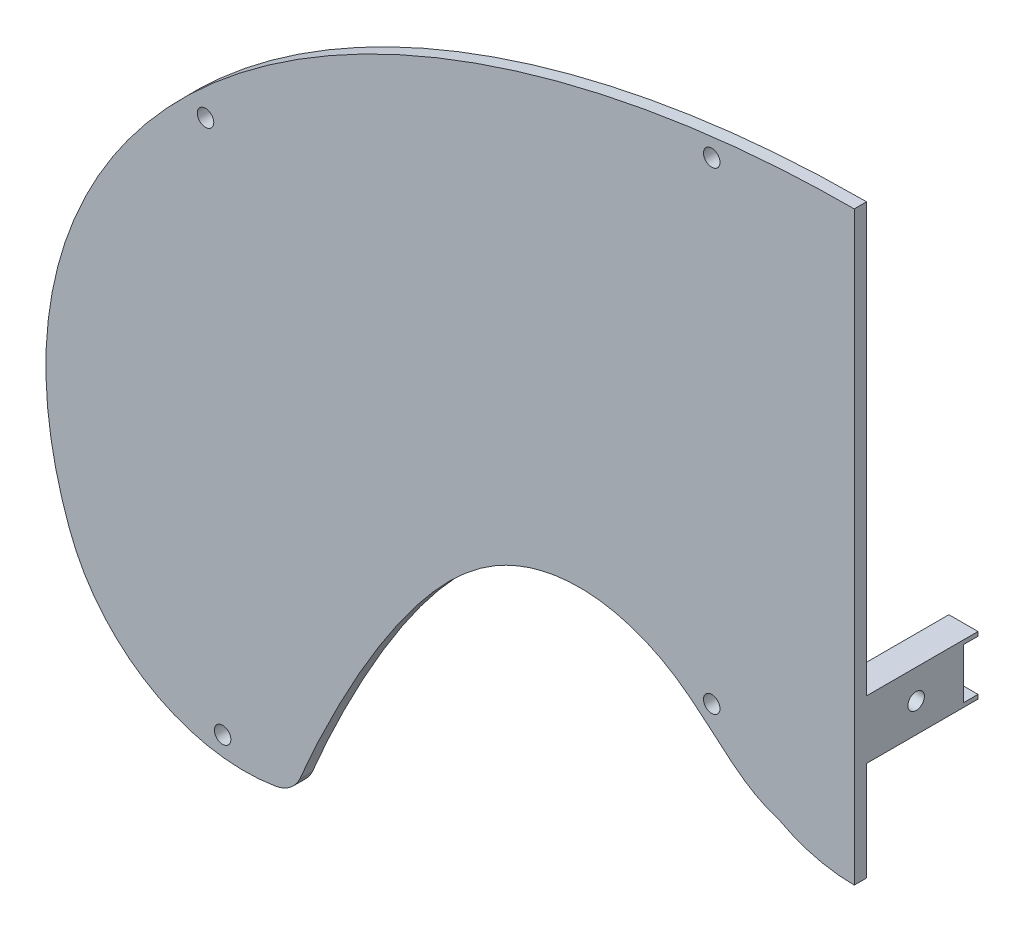
from build123d import *

# Parameters (mm, degrees)
CROQUIS7_R                 = 2.25
CROQUIS7_R_2               = 2
SALIENTE_EXTRUIR5_DEPTH    = 3
CROQUIS8_W                 = 14.2
CROQUIS8_H                 = 14.2
SALIENTE_EXTRUIR6_DEPTH    = 30
CROQUIS9_W                 = 12.2
CROQUIS9_H                 = 12.2
CORTAR_EXTRUIR3_DEPTH      = 3.5
CROQUIS10_R                = 1.5
CROQUIS10_W                = 52
CROQUIS10_H                = 60
CORTAR_EXTRUIR4_DEPTH      = 10
CROQUIS11_R                = 2
CORTAR_EXTRUIR5_DEPTH      = 244.062677057
CORTAR_EXTRUIR6_DEPTH      = 10
CORTAR_EXTRUIR6_DEPTH_BACK = 30


with BuildPart() as part:
    # Croquis7 → Saliente-Extruir5 (new body)
    with BuildSketch(Plane(origin=(0, 0, 0), x_dir=(-1, 0, 0), z_dir=(0, 0, 1))):
        with BuildLine():
            ThreePointArc((140.348102944, 60.535906772), (136.868803986, 59.039740818), (134.467588313, 56.110884882))
            add(Edge.make_bspline(
                [(134.467588313, 56.110884882), (134.149654238, 55.334133411), (133.822967437, 54.561974551), (133.162468089, 53.021395753), (132.827829682, 52.253409151), (131.813137405, 49.95510413), (129.740491118, 45.381193792), (127.554094799, 40.866968809), (124.537000873, 34.901469121), (122.977142227, 31.945642839), (119.740627649, 26.095274542), (118.063871011, 23.200785369), (115.441409795, 18.91536637), (114.549338579, 17.496294783), (112.72383113, 14.679856092), (111.790405163, 13.282650688), (108.93090019, 9.143306555), (106.942158815, 6.448783713), (103.789519774, 2.5408027), (102.709995436, 1.260750849), (101.03852657, -0.618140745), (100.472644941, -1.237551258), (99.321371183, -2.460973153), (98.735216612, -3.065706766), (96.949611744, -4.848397798), (95.725315546, -5.992490783), (93.193460811, -8.17168186), (91.885551874, -9.206321258), (89.163749912, -11.136861166), (87.750446472, -12.033533472), (85.542380661, -13.263200338), (84.789940556, -13.654501875), (83.273337808, -14.386945731), (82.507210908, -14.729300557), (80.185156663, -15.684162987), (78.605545886, -16.224438396), (76.18690973, -16.88473526), (75.372506069, -17.079850593), (73.726807841, -17.418565616), (72.893614615, -17.562445585), (68.705243638, -18.145869815), (65.366316414, -18.172349369), (61.206552273, -17.685687456), (60.375297364, -17.562248247), (58.714202725, -17.262432714), (57.885084071, -17.085992517), (55.432802766, -16.486020136), (53.833347943, -15.990242323), (50.701372835, -14.817551431), (49.168805031, -14.140766948), (46.919374597, -12.991848579), (46.176109393, -12.585433423), (44.71844096, -11.734682347), (44.00330992, -11.290078896), (41.89786804, -9.900210079), (40.548675898, -8.897248108), (37.915404815, -6.799959147), (36.631444442, -5.705240729), (34.080234787, -3.494531224), (32.813017874, -2.37801674), (30.236662295, -0.200762722), (28.927839074, 0.860396497), (26.200660035, 2.836986891), (24.782534521, 3.752724475), (22.513326989, 4.937380803), (21.731218891, 5.30092632), (20.538800155, 5.779648827), (20.137325925, 5.928599802), (19.528876591, 6.135464876), (19.325056364, 6.201754934), (18.915138447, 6.32828856), (18.709169476, 6.388873867), (18.503492991, 6.450235701)],
                knots=[0, 0, 0, 0, 0.015625, 0.015625, 0.03125, 0.03125, 0.0625, 0.125, 0.125, 0.1875, 0.1875, 0.25, 0.25, 0.28125, 0.28125, 0.3125, 0.3125, 0.375, 0.375, 0.40625, 0.40625, 0.421875, 0.421875, 0.4375, 0.4375, 0.46875, 0.46875, 0.5, 0.5, 0.53125, 0.53125, 0.546875, 0.546875, 0.5625, 0.5625, 0.59375, 0.59375, 0.609375, 0.609375, 0.625, 0.625, 0.6875, 0.6875, 0.703125, 0.703125, 0.71875, 0.71875, 0.75, 0.75, 0.78125, 0.78125, 0.796875, 0.796875, 0.8125, 0.8125, 0.84375, 0.84375, 0.875, 0.875, 0.90625, 0.90625, 0.9375, 0.9375, 0.96875, 0.96875, 0.984375, 0.984375, 0.9921875, 0.9921875, 0.99609375, 0.99609375, 1, 1, 1, 1], degree=3))
            ThreePointArc((18.503492991, 6.450235701), (9.568725558, 9.968187997), (0.041286445, 11.165669263))
            ThreePointArc((0.041286445, 11.165669263), (-9.486152668, 9.968187997), (-18.420920101, 6.450235701))
            add(Edge.make_bspline(
                [(-18.420920101, 6.450235701), (-18.623940111, 6.389666404), (-18.827355959, 6.329830822), (-19.231521602, 6.205217931), (-19.432092857, 6.140109685), (-20.029834347, 5.937422038), (-20.422847663, 5.792137477), (-21.586408936, 5.327592923), (-23.851571133, 4.283655696), (-25.957152112, 2.943922804), (-27.995784216, 1.480095188), (-28.664890842, 0.970984568), (-29.983921002, -0.073329511), (-31.932785293, -1.677966714), (-33.830609801, -3.348234863), (-37.648198778, -6.660559044), (-40.223642402, -8.829704647), (-43.732103414, -11.16931662), (-44.447751487, -11.619293464), (-45.90833942, -12.481581481), (-46.654055565, -12.894111913), (-48.910026429, -14.05945093), (-50.447191979, -14.745557377), (-53.587886072, -15.936216829), (-55.191605427, -16.440247818), (-57.65002542, -17.051733947), (-58.478840799, -17.231454942), (-60.152957814, -17.539864916), (-60.990189376, -17.667132679), (-65.177200996, -18.170568112), (-68.529524477, -18.150830669), (-72.723459823, -17.57652989), (-73.56537326, -17.433195972), (-75.227722525, -17.094199895), (-76.049649818, -16.898572429), (-78.48861692, -16.235921786), (-80.078810549, -15.693041625), (-82.413070582, -14.734529063), (-83.182665748, -14.391031128), (-84.704996506, -13.656396586), (-85.459349689, -13.264347284), (-87.686334065, -12.023619951), (-89.109100698, -11.119013238), (-91.845960574, -9.173794538), (-93.159325686, -8.13227129), (-95.699651961, -5.941089833), (-96.92657944, -4.791389468), (-99.311327975, -2.405501713), (-100.470747098, -1.167746926), (-102.705277757, 1.350255866), (-103.784333544, 2.63413345), (-106.931979291, 6.54404893), (-108.909553818, 9.229342103), (-112.69311531, 14.711639925), (-114.498345943, 17.509136981), (-117.975283478, 23.191061246), (-119.646743776, 26.075649006), (-122.879072623, 31.916824892), (-124.439905913, 34.873435974), (-127.463527635, 40.850489896), (-128.925763536, 43.869333899), (-131.039316303, 48.429617131), (-132.076557677, 50.718681564), (-133.080557539, 53.0229294), (-133.740912999, 54.563195318), (-134.0674355, 55.334997841), (-134.385015461, 56.110884961)],
                knots=[0, 0, 0, 0, 0.00390625, 0.00390625, 0.0078125, 0.0078125, 0.015625, 0.015625, 0.03125, 0.0625, 0.0625, 0.078125, 0.078125, 0.09375, 0.125, 0.125, 0.1875, 0.1875, 0.203125, 0.203125, 0.21875, 0.21875, 0.25, 0.25, 0.28125, 0.28125, 0.296875, 0.296875, 0.3125, 0.3125, 0.375, 0.375, 0.390625, 0.390625, 0.40625, 0.40625, 0.4375, 0.4375, 0.453125, 0.453125, 0.46875, 0.46875, 0.5, 0.5, 0.53125, 0.53125, 0.5625, 0.5625, 0.59375, 0.59375, 0.625, 0.625, 0.6875, 0.6875, 0.75, 0.75, 0.8125, 0.8125, 0.875, 0.875, 0.9375, 0.9375, 0.96875, 0.984375, 0.984375, 1, 1, 1, 1], degree=3))
            ThreePointArc((-134.385015461, 56.110884961), (-136.786231132, 59.039740844), (-140.265530055, 60.535906772))
            add(Edge.make_bspline(
                [(-140.265530055, 60.535906772), (-142.869313612, 60.975194236), (-145.472736764, 61.181545126), (-149.377353564, 61.156324129), (-150.678805664, 61.091795359), (-152.630851923, 60.909758714), (-153.281511997, 60.834852812), (-154.582787463, 60.656161872), (-155.234853603, 60.552101706), (-158.476802726, 59.961533397), (-160.993294496, 59.270458626), (-164.656700058, 57.918026872), (-165.859171506, 57.414272212), (-167.634457246, 56.578016163), (-168.221475639, 56.285808038), (-169.38587085, 55.674041203), (-169.964457435, 55.353726594), (-172.807439805, 53.697511994), (-174.937398486, 52.192576754), (-177.922607968, 49.673841605), (-178.882521506, 48.790456721), (-180.268716868, 47.398497719), (-180.721823613, 46.9233488), (-181.609804133, 45.950331764), (-182.044492036, 45.452521121), (-184.149785555, 42.932694997), (-185.636363328, 40.798932433), (-188.228703234, 36.30425224), (-189.334510792, 33.943361708), (-190.239592269, 31.46273884)],
                knots=[0, 0, 0, 0, 0.125, 0.125, 0.1875, 0.1875, 0.21875, 0.21875, 0.25, 0.25, 0.375, 0.375, 0.4375, 0.4375, 0.46875, 0.46875, 0.5, 0.5, 0.625, 0.625, 0.6875, 0.6875, 0.71875, 0.71875, 0.75, 0.75, 0.875, 0.875, 1, 1, 1, 1], degree=3))
            add(Edge.make_bspline(
                [(-190.239592269, 31.46273884), (-192.375255576, 25.696350204), (-193.930960398, 19.817912179), (-195.353011767, 10.824149994), (-195.674576312, 7.796775057), (-195.917624035, 3.209479486), (-195.95859604, 1.668142737), (-195.958829749, -1.399076424), (-195.918430127, -2.92654924), (-195.518471979, -10.533929614), (-194.56743795, -16.524250265), (-192.629288141, -23.898650857), (-192.204015591, -25.3678295), (-191.509820309, -27.563072124), (-191.268868279, -28.293875271), (-190.770797886, -29.745373087), (-190.513422668, -30.466933466), (-189.18582541, -34.054284362), (-187.99353352, -36.858768915), (-185.368434906, -42.346946573), (-183.935518187, -45.030584436), (-181.616583515, -48.97088495), (-180.815309976, -50.270107971), (-179.15756631, -52.840833163), (-178.299496505, -54.114584529), (-173.894487634, -60.387567833), (-170.029043597, -65.071235074), (-161.734486632, -73.885990461), (-157.304059995, -78.015790745), (-151.455251464, -82.873380155), (-150.269861365, -83.829577122), (-147.868570878, -85.712061036), (-146.651110312, -86.639504887), (-142.965561618, -89.369434932), (-140.47059657, -91.115230775), (-132.88142891, -96.148767416), (-127.683244876, -99.23322641), (-117.044436945, -104.928178838), (-111.603518482, -107.538096399), (-100.500242462, -112.325022089), (-94.837739322, -114.501745604), (-87.628813583, -116.966944585), (-86.180135392, -117.447244101), (-83.281186284, -118.37891039), (-78.92614565, -119.734494508), (-74.551754575, -120.967502962), (-65.778285791, -123.277142009), (-59.896441582, -124.608717398), (-48.071099861, -126.88132439), (-42.127581641, -127.822224818), (-30.181011709, -129.326909852), (-18.174890213, -130.454364585), (-6.05076732, -130.834337664), (0.041286395, -130.834337718)],
                knots=[0, 0, 0, 0, 0.0625, 0.0625, 0.09375, 0.09375, 0.109375, 0.109375, 0.125, 0.125, 0.1875, 0.1875, 0.203125, 0.203125, 0.2109375, 0.2109375, 0.21875, 0.21875, 0.25, 0.25, 0.28125, 0.28125, 0.296875, 0.296875, 0.3125, 0.3125, 0.375, 0.375, 0.4375, 0.4375, 0.453125, 0.453125, 0.46875, 0.46875, 0.5, 0.5, 0.5625, 0.5625, 0.625, 0.625, 0.6875, 0.6875, 0.703125, 0.703125, 0.71875, 0.75, 0.75, 0.8125, 0.8125, 0.875, 0.875, 0.9375, 1, 1, 1, 1], degree=3))
            add(Edge.make_bspline(
                [(0.041286395, -130.834337718), (6.134538372, -130.834337861), (18.261394111, -130.454215542), (30.270890379, -129.326191765), (42.221146328, -127.820644803), (48.166664918, -126.879178393), (59.996316501, -124.605051093), (65.880471618, -123.272531195), (74.657643286, -120.961098273), (79.033976886, -119.727301499), (83.391005428, -118.370478603), (86.291297223, -117.437928825), (87.740322905, -116.957264458), (94.94849915, -114.491286465), (100.612718757, -112.313197934), (111.723756279, -107.520808049), (117.170703974, -104.9067671), (127.825648694, -99.19923472), (133.033931688, -96.106317082), (139.373186051, -91.896862023), (140.632464259, -91.037770104), (143.133063373, -89.283555245), (144.374861494, -88.388007586), (148.052238664, -85.660160511), (150.446425915, -83.782144112), (157.447735696, -77.960356266), (161.874926497, -73.830213662), (168.100826372, -67.205265408), (170.107260305, -64.925618709), (173.00207465, -61.387202315), (173.947865617, -60.187897794), (175.799183824, -57.747584062), (176.704009528, -56.507250952), (181.087838152, -50.248918472), (184.175371038, -45.022352222), (188.097143692, -36.810598338), (189.285816024, -34.01118958), (190.610308183, -30.427356556), (190.867135429, -29.70635937), (191.364231806, -28.255685919), (191.604838096, -27.524920821), (192.298313078, -25.328623504), (192.722722681, -23.859837654), (194.655712304, -16.493027919), (195.598905702, -10.526579041), (196.07921656, -1.463811899), (196.083096745, 1.576017168), (195.845385004, 6.165233834), (195.724990331, 7.703216662), (195.405329025, 10.754442145), (195.206051361, 12.271290951), (194.017367953, 19.812812816), (192.45374436, 25.709911997), (190.316013842, 31.479461946)],
                knots=[0, 0, 0, 0, 0.0625, 0.125, 0.125, 0.1875, 0.1875, 0.25, 0.25, 0.28125, 0.296875, 0.296875, 0.3125, 0.3125, 0.375, 0.375, 0.4375, 0.4375, 0.5, 0.5, 0.515625, 0.515625, 0.53125, 0.53125, 0.5625, 0.5625, 0.625, 0.625, 0.65625, 0.65625, 0.671875, 0.671875, 0.6875, 0.6875, 0.75, 0.75, 0.78125, 0.78125, 0.7890625, 0.7890625, 0.796875, 0.796875, 0.8125, 0.8125, 0.875, 0.875, 0.90625, 0.90625, 0.921875, 0.921875, 0.9375, 0.9375, 1, 1, 1, 1], degree=3))
            ThreePointArc((190.316013842, 31.479461946), (170.584652034, 55.040486981), (140.348102944, 60.535906772))
        make_face()
        with Locations(Location((-153.110491216, 56.165669263, 0), (0, 0, 180))):
            Circle(CROQUIS7_R, mode=Mode.SUBTRACT)
        with Locations(Location((-34.515211049, -9.615590181, 0), (0, 0, 180))):
            Circle(CROQUIS7_R, mode=Mode.SUBTRACT)
        with Locations(Location((34.597783939, -9.615590181, 0), (0, 0, 180))):
            Circle(CROQUIS7_R_2, mode=Mode.SUBTRACT)
        with Locations(Location((153.193064106, 56.165669263, 0), (0, 0, 180))):
            Circle(CROQUIS7_R_2, mode=Mode.SUBTRACT)
        with Locations(Location((-157.251517535, -72.229628149, 0), (0, 0, 180))):
            Circle(CROQUIS7_R, mode=Mode.SUBTRACT)
        with Locations(Location((-34.515211049, -124.304498834, 0), (0, 0, 180))):
            Circle(CROQUIS7_R, mode=Mode.SUBTRACT)
        with Locations(Location((34.597783939, -124.304498834, 0), (0, 0, 180))):
            Circle(CROQUIS7_R_2, mode=Mode.SUBTRACT)
        with Locations(Location((157.334090424, -71.312448831, 0), (0, 0, 180))):
            Circle(CROQUIS7_R_2, mode=Mode.SUBTRACT)
    extrude(amount=SALIENTE_EXTRUIR5_DEPTH)

    # Croquis8 → Saliente-Extruir6 (add)
    with BuildSketch(Plane.XY.offset(3)):
        with Locations((0, 20)):
            Rectangle(CROQUIS8_W, CROQUIS8_H)
    extrude(amount=-SALIENTE_EXTRUIR6_DEPTH)

    # Croquis9 → Cortar-Extruir3 (cut)
    with BuildSketch(Plane(origin=(0, 0, -27), x_dir=(-1, 0, 0), z_dir=(0, 0, -1))):
        with Locations((0, 20)):
            Rectangle(CROQUIS9_W, CROQUIS9_H)
    extrude(amount=-CORTAR_EXTRUIR3_DEPTH, mode=Mode.SUBTRACT)

    # Croquis10 → Cortar-Extruir4 (cut)
    with BuildSketch(Plane.XY.offset(3)):
        with Locations((153.110491216, 41.334330737)):
            Circle(CROQUIS10_R)
        with Locations((153.110491216, -23.665669263)):
            Circle(CROQUIS10_R)
        with Locations((153.110491216, 8.834330737)):
            Rectangle(CROQUIS10_W, CROQUIS10_H)
    extrude(amount=-CORTAR_EXTRUIR4_DEPTH, mode=Mode.SUBTRACT)

    # Croquis11 → Cortar-Extruir5 (cut, through all)
    with BuildSketch(Plane.ZY.offset(7.1)):
        with Locations(Location((-12, 20, 0), (0, 0, 270))):
            Circle(CROQUIS11_R)
    extrude(amount=-CORTAR_EXTRUIR5_DEPTH, mode=Mode.SUBTRACT)

    # Croquis12 → Cortar-Extruir6 (cut, two sides: drawn at the far end of the back side and taken through both)
    with BuildSketch(Plane.XY.offset(3).offset(-CORTAR_EXTRUIR6_DEPTH_BACK)):
        with BuildLine():
            Line((-0.041286395, -11.165669263), (-0.041286395, 130.834337718))
            add(Edge.make_bspline(
                [(190.239592269, -31.46273884), (192.375255576, -25.696350204), (193.930960398, -19.817912179), (195.353011767, -10.824149994), (195.674576312, -7.796775057), (195.917624035, -3.209479486), (195.95859604, -1.668142737), (195.958829749, 1.399076424), (195.918430127, 2.92654924), (195.518471979, 10.533929614), (194.56743795, 16.524250265), (192.629288141, 23.898650857), (192.204015591, 25.3678295), (191.509820309, 27.563072124), (191.268868279, 28.293875271), (190.770797886, 29.745373087), (190.513422668, 30.466933466), (189.18582541, 34.054284362), (187.99353352, 36.858768915), (185.368434906, 42.346946573), (183.935518187, 45.030584436), (181.616583515, 48.97088495), (180.815309976, 50.270107971), (179.15756631, 52.840833163), (178.299496505, 54.114584529), (173.894487634, 60.387567833), (170.029043597, 65.071235074), (161.734486632, 73.885990461), (157.304059995, 78.015790745), (151.455251464, 82.873380155), (150.269861365, 83.829577122), (147.868570878, 85.712061036), (146.651110312, 86.639504887), (142.965561618, 89.369434932), (140.47059657, 91.115230775), (132.88142891, 96.148767416), (127.683244876, 99.23322641), (117.044436945, 104.928178838), (111.603518482, 107.538096399), (100.500242462, 112.325022089), (94.837739322, 114.501745604), (87.628813583, 116.966944585), (86.180135392, 117.447244101), (83.281186284, 118.37891039), (78.92614565, 119.734494508), (74.551754575, 120.967502962), (65.778285791, 123.277142009), (59.896441582, 124.608717398), (48.071099861, 126.88132439), (42.127581641, 127.822224818), (30.181011709, 129.326909852), (18.174890213, 130.454364585), (6.05076732, 130.834337664), (-0.041286395, 130.834337718)],
                knots=[0, 0, 0, 0, 0.0625, 0.0625, 0.09375, 0.09375, 0.109375, 0.109375, 0.125, 0.125, 0.1875, 0.1875, 0.203125, 0.203125, 0.2109375, 0.2109375, 0.21875, 0.21875, 0.25, 0.25, 0.28125, 0.28125, 0.296875, 0.296875, 0.3125, 0.3125, 0.375, 0.375, 0.4375, 0.4375, 0.453125, 0.453125, 0.46875, 0.46875, 0.5, 0.5, 0.5625, 0.5625, 0.625, 0.625, 0.6875, 0.6875, 0.703125, 0.703125, 0.71875, 0.75, 0.75, 0.8125, 0.8125, 0.875, 0.875, 0.9375, 1, 1, 1, 1], degree=3))
            add(Edge.make_bspline(
                [(140.265530055, -60.535906772), (142.869313612, -60.975194236), (145.472736764, -61.181545126), (149.377353564, -61.156324129), (150.678805664, -61.091795359), (152.630851923, -60.909758714), (153.281511997, -60.834852812), (154.582787463, -60.656161872), (155.234853603, -60.552101706), (158.476802726, -59.961533397), (160.993294496, -59.270458626), (164.656700058, -57.918026872), (165.859171506, -57.414272212), (167.634457246, -56.578016163), (168.221475639, -56.285808038), (169.38587085, -55.674041203), (169.964457435, -55.353726594), (172.807439805, -53.697511994), (174.937398486, -52.192576754), (177.922607968, -49.673841605), (178.882521506, -48.790456721), (180.268716868, -47.398497719), (180.721823613, -46.9233488), (181.609804133, -45.950331764), (182.044492036, -45.452521121), (184.149785555, -42.932694997), (185.636363328, -40.798932433), (188.228703234, -36.30425224), (189.334510792, -33.943361708), (190.239592269, -31.46273884)],
                knots=[0, 0, 0, 0, 0.125, 0.125, 0.1875, 0.1875, 0.21875, 0.21875, 0.25, 0.25, 0.375, 0.375, 0.4375, 0.4375, 0.46875, 0.46875, 0.5, 0.5, 0.625, 0.625, 0.6875, 0.6875, 0.71875, 0.71875, 0.75, 0.75, 0.875, 0.875, 1, 1, 1, 1], degree=3))
            ThreePointArc((140.265530055, -60.535906772), (136.786231132, -59.039740844), (134.385015461, -56.110884961))
            add(Edge.make_bspline(
                [(18.420920101, -6.450235701), (18.623940111, -6.389666404), (18.827355959, -6.329830822), (19.231521602, -6.205217931), (19.432092857, -6.140109685), (20.029834347, -5.937422038), (20.422847663, -5.792137477), (21.586408936, -5.327592923), (23.851571133, -4.283655696), (25.957152112, -2.943922804), (27.995784216, -1.480095188), (28.664890842, -0.970984568), (29.983921002, 0.073329511), (31.932785293, 1.677966714), (33.830609801, 3.348234863), (37.648198778, 6.660559044), (40.223642402, 8.829704647), (43.732103414, 11.16931662), (44.447751487, 11.619293464), (45.90833942, 12.481581481), (46.654055565, 12.894111913), (48.910026429, 14.05945093), (50.447191979, 14.745557377), (53.587886072, 15.936216829), (55.191605427, 16.440247818), (57.65002542, 17.051733947), (58.478840799, 17.231454942), (60.152957814, 17.539864916), (60.990189376, 17.667132679), (65.177200996, 18.170568112), (68.529524477, 18.150830669), (72.723459823, 17.57652989), (73.56537326, 17.433195972), (75.227722525, 17.094199895), (76.049649818, 16.898572429), (78.48861692, 16.235921786), (80.078810549, 15.693041625), (82.413070582, 14.734529063), (83.182665748, 14.391031128), (84.704996506, 13.656396586), (85.459349689, 13.264347284), (87.686334065, 12.023619951), (89.109100698, 11.119013238), (91.845960574, 9.173794538), (93.159325686, 8.13227129), (95.699651961, 5.941089833), (96.92657944, 4.791389468), (99.311327975, 2.405501713), (100.470747098, 1.167746926), (102.705277757, -1.350255866), (103.784333544, -2.63413345), (106.931979291, -6.54404893), (108.909553818, -9.229342103), (112.69311531, -14.711639925), (114.498345943, -17.509136981), (117.975283478, -23.191061246), (119.646743776, -26.075649006), (122.879072623, -31.916824892), (124.439905913, -34.873435974), (127.463527635, -40.850489896), (128.925763536, -43.869333899), (131.039316303, -48.429617131), (132.076557677, -50.718681564), (133.080557539, -53.0229294), (133.740912999, -54.563195318), (134.0674355, -55.334997841), (134.385015461, -56.110884961)],
                knots=[0, 0, 0, 0, 0.00390625, 0.00390625, 0.0078125, 0.0078125, 0.015625, 0.015625, 0.03125, 0.0625, 0.0625, 0.078125, 0.078125, 0.09375, 0.125, 0.125, 0.1875, 0.1875, 0.203125, 0.203125, 0.21875, 0.21875, 0.25, 0.25, 0.28125, 0.28125, 0.296875, 0.296875, 0.3125, 0.3125, 0.375, 0.375, 0.390625, 0.390625, 0.40625, 0.40625, 0.4375, 0.4375, 0.453125, 0.453125, 0.46875, 0.46875, 0.5, 0.5, 0.53125, 0.53125, 0.5625, 0.5625, 0.59375, 0.59375, 0.625, 0.625, 0.6875, 0.6875, 0.75, 0.75, 0.8125, 0.8125, 0.875, 0.875, 0.9375, 0.9375, 0.96875, 0.984375, 0.984375, 1, 1, 1, 1], degree=3))
            ThreePointArc((18.420920101, -6.450235701), (9.486152693, -9.968187991), (-0.041286395, -11.165669263))
        make_face()
    extrude(amount=CORTAR_EXTRUIR6_DEPTH + CORTAR_EXTRUIR6_DEPTH_BACK, mode=Mode.SUBTRACT)


solid = part.part
